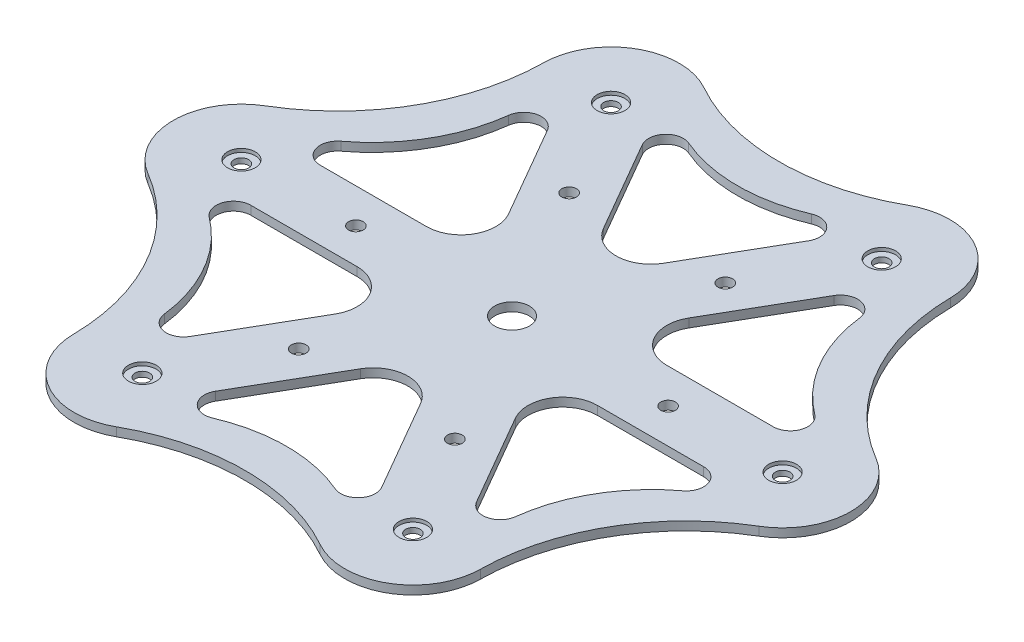
from build123d import *

# Parameters (mm, degrees)
SKETCH_2_R               = 5
EXTRUDE_1_DEPTH          = 2.5
SKETCH_3_R               = 2.1
CUT_EXTRUDE_1_DEPTH      = 2.5
EXTRUDE_2_DEPTH          = 2.5
SKETCH_5_R               = 2.1
CUT_EXTRUDE_2_DEPTH      = 10
CUT_EXTRUDE_3_DEPTH      = 10
SKETCH_10_R              = 4
CUT_EXTRUDE_5_DEPTH      = 1
SKETCH_11_R              = 10
SKETCH_11_R_2            = 5
CUT_EXTRUDE_6_DEPTH      = 131.938989117
PATTERN_CIRCULAR_1_COUNT = 6


with BuildPart() as part:
    # 草图2 → 凸台-拉伸1 (new body)
    with BuildSketch(Plane(origin=(0, 0, 0), x_dir=(1, 0, 0), z_dir=(0, 1, 0))):
        Polygon((-54.5, 0), (-27.25, -47.198384506), (27.25, -47.198384506), (54.5, 0), (27.25, 47.198384506), (-27.25, 47.198384506), align=None)
        with Locations(Location((0, 0, 0), (0, 0, 270))):
            Circle(SKETCH_2_R, mode=Mode.SUBTRACT)
    extrude(amount=EXTRUDE_1_DEPTH)

    # 草图3 → 切除-拉伸1 (cut)
    with BuildSketch(Plane(origin=(0, 2.5, 0), x_dir=(1, 0, 0), z_dir=(0, 1, 0))):
        with Locations(Location((-22.5, 38.97114317, 0), (0, 0, 270))):
            Circle(SKETCH_3_R)
        with Locations(Location((22.5, 38.97114317, 0), (0, 0, 270))):
            Circle(SKETCH_3_R)
        with Locations(Location((45, 0, 0), (0, 0, 270))):
            Circle(SKETCH_3_R)
        with Locations(Location((22.5, -38.97114317, 0), (0, 0, 270))):
            Circle(SKETCH_3_R)
        with Locations(Location((-22.5, -38.97114317, 0), (0, 0, 270))):
            Circle(SKETCH_3_R)
        with Locations(Location((-45, 0, 0), (0, 0, 270))):
            Circle(SKETCH_3_R)
    extrude(amount=-CUT_EXTRUDE_1_DEPTH, mode=Mode.SUBTRACT)

    # 草图4 → 凸台-拉伸2 (add)
    with BuildSketch(Plane(origin=(0, 2.5, 0), x_dir=(1, 0, 0), z_dir=(0, 1, 0))):
        Polygon((-100.688021535, 0), (-50.344010768, -87.198384506), (50.344010768, -87.198384506), (100.688021535, 0), (50.344010768, 87.198384506), (-50.344010768, 87.198384506), align=None)
        Polygon((-54.5, 0), (-27.25, -47.198384506), (27.25, -47.198384506), (54.5, 0), (27.25, 47.198384506), (-27.25, 47.198384506), align=None, mode=Mode.SUBTRACT)
    extrude(amount=-EXTRUDE_2_DEPTH)

    # 草图5 → 切除-拉伸2 (cut)
    with BuildSketch(Plane(origin=(0, 2.5, 0), x_dir=(1, 0, 0), z_dir=(0, 1, 0))):
        with Locations(Location((-39, 67.549981495, 0), (0, 0, 270))):
            Circle(SKETCH_5_R)
        with Locations(Location((39, 67.549981495, 0), (0, 0, 270))):
            Circle(SKETCH_5_R)
        with Locations(Location((78, 0, 0), (0, 0, 270))):
            Circle(SKETCH_5_R)
        with Locations(Location((39, -67.549981495, 0), (0, 0, 270))):
            Circle(SKETCH_5_R)
        with Locations(Location((-39, -67.549981495, 0), (0, 0, 270))):
            Circle(SKETCH_5_R)
        with Locations(Location((-78, 0, 0), (0, 0, 270))):
            Circle(SKETCH_5_R)
    extrude(amount=-CUT_EXTRUDE_2_DEPTH, mode=Mode.SUBTRACT)

    # 草图8 → 切除-拉伸3 (cut)
    with BuildSketch(Plane(origin=(0, 2.5, 0), x_dir=(1, 0, 0), z_dir=(0, 1, 0))):
        with BuildLine():
            ThreePointArc((-38.999999879, 87.198384506), (-34.02771086, 86.55882369), (-29.37912053, 84.681777055))
            ThreePointArc((-29.37912053, 84.681777055), (2.23e-07, 76.996854011), (29.379120918, 84.681777273))
            ThreePointArc((29.379120918, 84.681777273), (34.027711134, 86.558823762), (39, 87.198384506))
            Line((39, 87.198384506), (-38.999999879, 87.198384506))
        make_face()
        with BuildLine():
            ThreePointArc((-58.647009902, 67.78395331), (-57.948284774, 72.748274003), (-56.016016118, 77.374183058))
            Line((-56.016016118, 77.374183058), (-95.016015856, 9.824202017))
            ThreePointArc((-95.016015856, 9.824202017), (-91.975995068, 13.810550415), (-88.026129369, 16.897824439))
            ThreePointArc((-88.026129369, 16.897824439), (-66.68123126, 38.498427568), (-58.647009902, 67.78395331))
        make_face()
        with BuildLine():
            ThreePointArc((-56.016016118, 77.374183058), (-48.824201425, 84.565997693), (-38.999999879, 87.198384506))
            Line((-38.999999879, 87.198384506), (-50.344010768, 87.198384506))
            Line((-50.344010768, 87.198384506), (-56.016016118, 77.374183058))
        make_face()
        with BuildLine():
            Line((50.344010768, 87.198384506), (39, 87.198384506))
            ThreePointArc((39, 87.198384506), (48.824200892, 84.565998001), (56.016015443, 77.374184228))
            Line((56.016015443, 77.374184228), (50.344010768, 87.198384506))
        make_face()
        with BuildLine():
            ThreePointArc((-95.016016282, -9.824201279), (-97.648403011, 4.26e-07), (-95.016015856, 9.824202017))
            Line((-95.016015856, 9.824202017), (-100.688021535, 0))
            Line((-100.688021535, 0), (-95.016016282, -9.824201279))
        make_face()
        with BuildLine():
            ThreePointArc((56.016015443, 77.374184228), (57.948284693, 72.7482743), (58.64700991, 67.783952574))
            ThreePointArc((58.64700991, 67.783952574), (66.681231635, 38.498426919), (88.026130025, 16.89782405))
            ThreePointArc((88.026130025, 16.89782405), (91.975995629, 13.810549846), (95.016016274, 9.824201294))
            Line((95.016016274, 9.824201294), (56.016015443, 77.374184228))
        make_face()
        with BuildLine():
            Line((-95.016016282, -9.824201279), (-56.016017948, -77.374179889))
            ThreePointArc((-56.016017948, -77.374179889), (-57.948285332, -72.748271969), (-58.647009908, -67.783952751))
            ThreePointArc((-58.647009908, -67.783952751), (-66.681232791, -38.498424916), (-88.026134156, -16.897821598))
            ThreePointArc((-88.026134156, -16.897821598), (-91.975997324, -13.810548132), (-95.016016282, -9.824201279))
        make_face()
        with BuildLine():
            Line((100.688021535, 0), (95.016016274, 9.824201294))
            ThreePointArc((95.016016274, 9.824201294), (97.648403011, -1.459e-06), (95.016014815, -9.824203821))
            Line((95.016014815, -9.824203821), (100.688021535, 0))
        make_face()
        with BuildLine():
            ThreePointArc((95.016014815, -9.824203821), (91.975994622, -13.810550865), (88.02613007, -16.897824023))
            ThreePointArc((88.02613007, -16.897824023), (66.681231717, -38.498426777), (58.647009914, -67.783952298))
            ThreePointArc((58.647009914, -67.783952298), (57.948284908, -72.748273515), (56.016016118, -77.374183058))
            Line((56.016016118, -77.374183058), (95.016014815, -9.824203821))
        make_face()
        with BuildLine():
            ThreePointArc((-39, -87.198384506), (-48.824203062, -84.565996748), (-56.016017948, -77.374179889))
            Line((-56.016017948, -77.374179889), (-50.344010768, -87.198384506))
            Line((-50.344010768, -87.198384506), (-39, -87.198384506))
        make_face()
        with BuildLine():
            Line((-39, -87.198384506), (39.000000014, -87.198384506))
            ThreePointArc((39.000000014, -87.198384506), (34.027710452, -86.558823583), (29.379119676, -84.681776576))
            ThreePointArc((29.379119676, -84.681776576), (-7.65e-07, -76.996854011), (-29.37912101, -84.681777325))
            ThreePointArc((-29.37912101, -84.681777325), (-34.027711185, -86.558823775), (-39, -87.198384506))
        make_face()
        with BuildLine():
            Line((50.344010768, -87.198384506), (56.016016118, -77.374183058))
            ThreePointArc((56.016016118, -77.374183058), (48.824201483, -84.565997659), (39.000000014, -87.198384506))
            Line((39.000000014, -87.198384506), (50.344010768, -87.198384506))
        make_face()
    extrude(amount=-CUT_EXTRUDE_3_DEPTH, mode=Mode.SUBTRACT)

    # 草图10 → 切除-拉伸5 (cut)
    with BuildSketch(Plane(origin=(0, 2.5, 0), x_dir=(1, 0, 0), z_dir=(0, 1, 0))):
        with Locations(Location((-78, 0, 0), (0, 0, 270))):
            Circle(SKETCH_10_R)
        with Locations(Location((-39, 67.549981495, 0), (0, 0, 270))):
            Circle(SKETCH_10_R)
        with Locations(Location((39, 67.549981495, 0), (0, 0, 270))):
            Circle(SKETCH_10_R)
        with Locations(Location((78, 0, 0), (0, 0, 270))):
            Circle(SKETCH_10_R)
        with Locations(Location((39, -67.549981495, 0), (0, 0, 270))):
            Circle(SKETCH_10_R)
        with Locations(Location((-39, -67.549981495, 0), (0, 0, 270))):
            Circle(SKETCH_10_R)
    extrude(amount=-CUT_EXTRUDE_5_DEPTH, mode=Mode.SUBTRACT)

    # 草图11 → 切除-拉伸6 (cut, through all)
    with BuildSketch(Plane.XZ):
        with BuildLine():
            Line((-34.641016151, -10), (-65.262794416, -10))
            ThreePointArc((-65.262794416, -10), (-61.72726051, -11.464466094), (-60.262794416, -15))
            ThreePointArc((-60.262794416, -15), (-63.026726517, -19.472135994), (-68.262794556, -18.999999895))
            ThreePointArc((-68.262794556, -18.999999895), (-56.291651297, -32.499999912), (-50.585879884, -49.617314069))
            ThreePointArc((-50.585879884, -49.617314069), (-45.921354555, -44.028220551), (-40.621778265, -49.019237886))
            ThreePointArc((-40.621778265, -49.019237886), (-40.792149144, -50.313333152), (-41.291651287, -51.519237957))
            Line((-41.291651287, -51.519237957), (-25.980762149, -25.000000062))
            ThreePointArc((-25.980762149, -25.000000062), (-43.301270207, -24.999999969), (-34.641016151, -10))
        make_face()
        with Locations((-34.641016151, -20)):
            Circle(SKETCH_11_R)
        with Locations((-65.262794416, -15)):
            Circle(SKETCH_11_R_2)
        with Locations((-45.621778265, -49.019237886)):
            Circle(SKETCH_11_R_2)
    cut_extrude_6 = extrude(amount=-CUT_EXTRUDE_6_DEPTH, mode=Mode.SUBTRACT)

    # 阵列(圆周)1: 切除-拉伸6 ×6 about axis
    pattern_circular_1_axis = Axis((0, 0, 0), (0, 1, 0))
    for i in range(1, PATTERN_CIRCULAR_1_COUNT):
        add(cut_extrude_6.rotate(pattern_circular_1_axis, i * 360 / PATTERN_CIRCULAR_1_COUNT), mode=Mode.SUBTRACT)


solid = part.part
